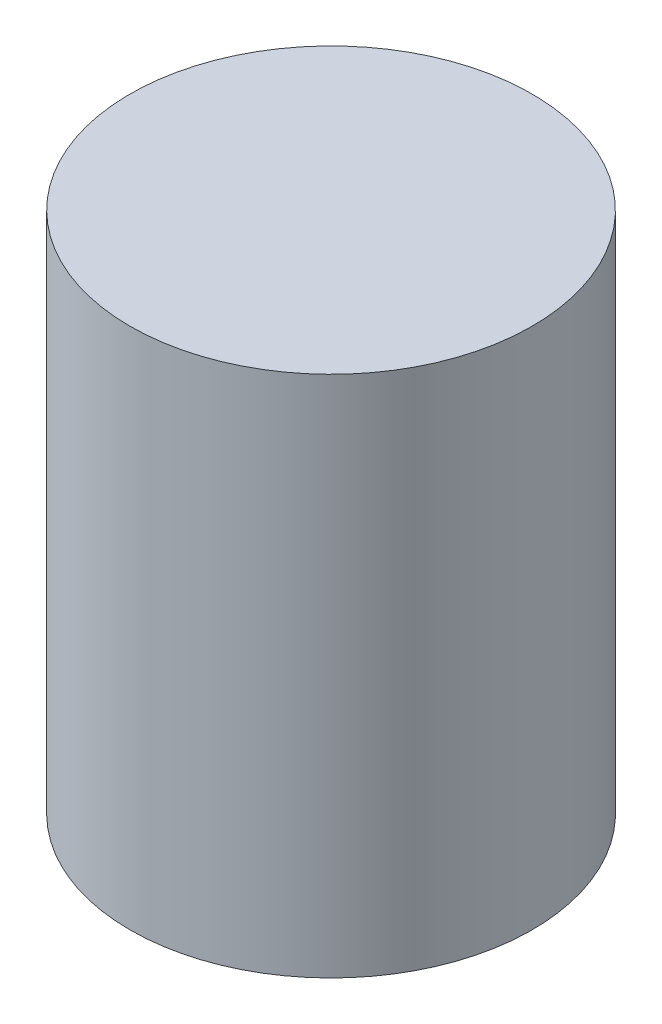
from build123d import *

# Parameters (mm, degrees)
SKETCH_1_R      = 4.5
EXTRUDE_1_DEPTH = 11.7


with BuildPart() as part:
    # 草图1 → 凸台-拉伸1 (new body)
    with BuildSketch(Plane(origin=(0, 0, 0), x_dir=(1, 0, 0), z_dir=(0, 1, 0))):
        with Locations(Location((-30.107395375, 28.413854385, 0), (0, 0, 270))):
            Circle(SKETCH_1_R)
    extrude(amount=EXTRUDE_1_DEPTH)


solid = part.part
